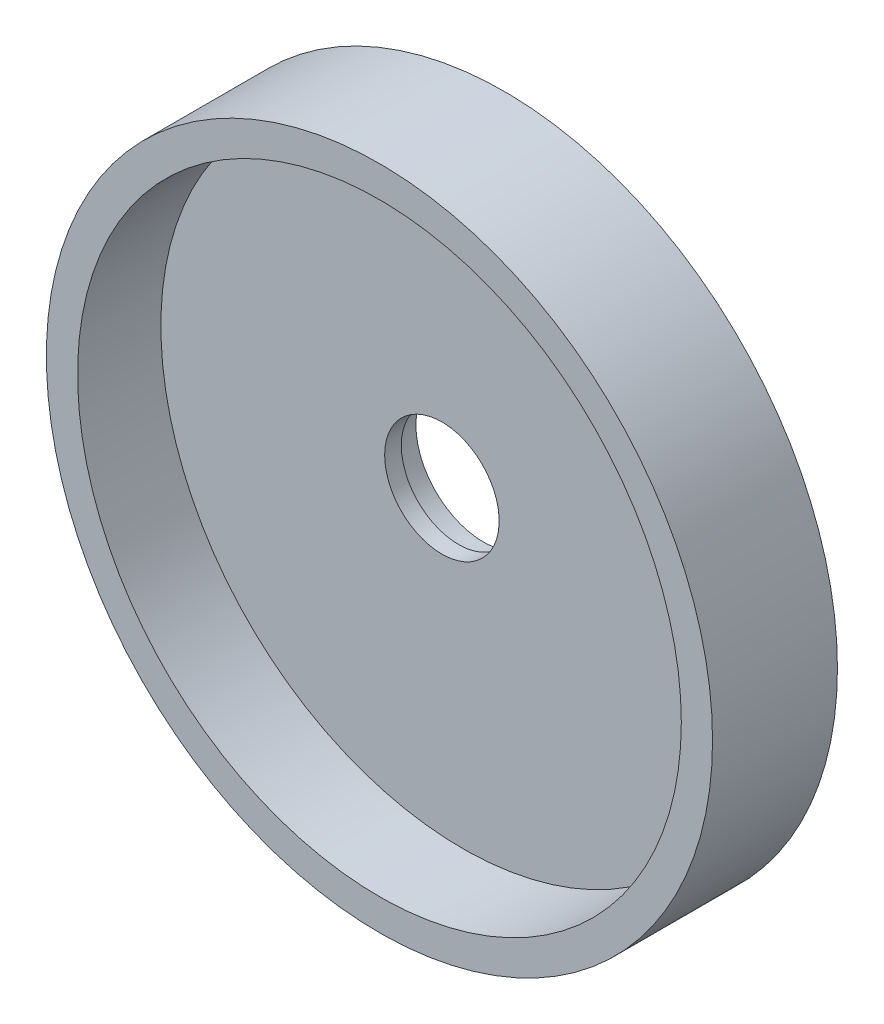
from build123d import *

# Parameters (mm, degrees)
SKETCH1_R           = 16
BOSS_EXTRUDE1_DEPTH = 6
SKETCH3_R           = 14.5
CUT_EXTRUDE1_DEPTH  = 4
SKETCH4_R           = 2.75
CUT_EXTRUDE2_DEPTH  = 2
SKETCH6_R           = 3.25
CUT_EXTRUDE3_DEPTH  = 1.2
DRAFT4_ANGLE        = 3


with BuildPart() as part:
    # Sketch1 → Boss-Extrude1 (new body)
    with BuildSketch(Plane.XY):
        Circle(SKETCH1_R)
    extrude(amount=BOSS_EXTRUDE1_DEPTH)

    # Sketch3 → Cut-Extrude1 (cut)
    with BuildSketch(Plane.XY.offset(6)):
        Circle(SKETCH3_R)
    extrude(amount=-CUT_EXTRUDE1_DEPTH, mode=Mode.SUBTRACT)

    # Sketch4 → Cut-Extrude2 (cut)
    with BuildSketch(Plane(origin=(0, 0, 0), x_dir=(-1, 0, 0), z_dir=(0, 0, -1))):
        with Locations((1, 0)):
            Circle(SKETCH4_R)
    extrude(amount=-CUT_EXTRUDE2_DEPTH, mode=Mode.SUBTRACT)

    # Sketch6 → Cut-Extrude3 (cut)
    with BuildSketch(Plane(origin=(0, 0, 0), x_dir=(-1, 0, 0), z_dir=(0, 0, -1))):
        with Locations((1, 0)):
            Circle(SKETCH6_R)
    extrude(amount=-CUT_EXTRUDE3_DEPTH, mode=Mode.SUBTRACT)

    # Draft4
    draft4_faces = [part.faces().sort_by_distance(p)[0] for p in [
        (2.25, 0, 0.6),
    ]]
    draft(draft4_faces, Plane(origin=(0, 0, 0), x_dir=(-1, 0, 0), z_dir=(0, 0, -1)), DRAFT4_ANGLE)


solid = part.part
